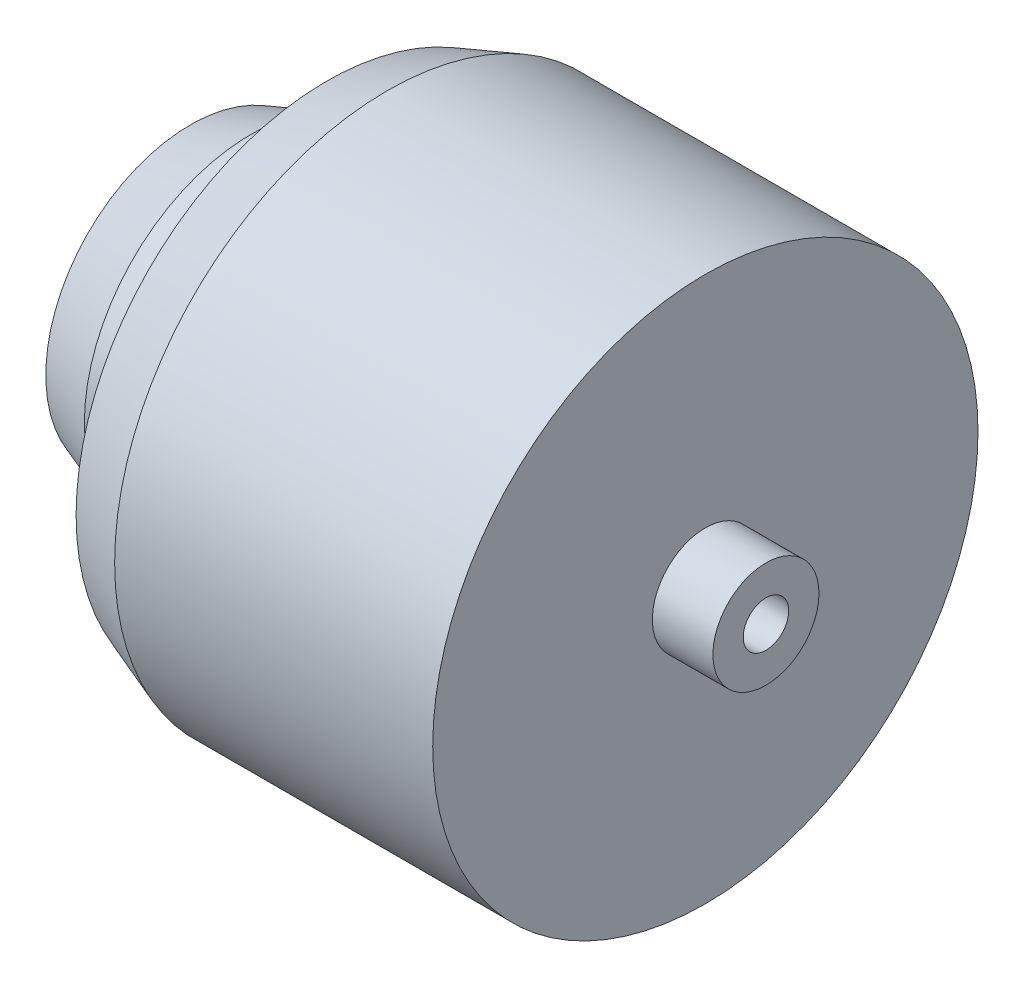
from build123d import *
from OCP.BRepFilletAPI import BRepFilletAPI_MakeChamfer

# Parameters (mm, degrees)
SKETCH1_R                    = 18
BOSS_EXTRUDE1_DEPTH          = 38
SKETCH2_OUTSIDE_W            = 50.706
SKETCH2_OUTSIDE_H            = 50.706
SKETCH2_OUTSIDE_R            = 3.5
CUT_EXTRUDE1_DEPTH           = 4
SKETCH3_OUTSIDE_W            = 50.706
SKETCH3_OUTSIDE_H            = 50.706
SKETCH3_OUTSIDE_R            = 11
CUT_EXTRUDE2_DEPTH           = 9
CHAMFER1_SIZE                = 4
CHAMFER1_SIZE2               = 1.455880937
F_3_0_3_DIAMETER_HOLE1_D     = 3
F_3_0_3_DIAMETER_HOLE1_DEPTH = 34.098709071
F_3_0_3_DIAMETER_HOLE1_TIP   = 0.901290929


with BuildPart() as part:
    # Sketch1 → Boss-Extrude1 (new body)
    with BuildSketch(Plane(origin=(0, 0, 0), x_dir=(0, 0, -1), z_dir=(1, 0, 0))):
        Circle(SKETCH1_R)
    extrude(amount=BOSS_EXTRUDE1_DEPTH)

    # Sketch2 outside → Cut-Extrude1 (cut)
    with BuildSketch(Plane(origin=(38, 0, 0), x_dir=(0, 0, -1), z_dir=(1, 0, 0))):
        Rectangle(SKETCH2_OUTSIDE_W, SKETCH2_OUTSIDE_H)
        Circle(SKETCH2_OUTSIDE_R, mode=Mode.SUBTRACT)
    extrude(amount=-CUT_EXTRUDE1_DEPTH, mode=Mode.SUBTRACT)

    # Sketch3 outside → Cut-Extrude2 (cut)
    with BuildSketch(Plane.ZY):
        Rectangle(SKETCH3_OUTSIDE_W, SKETCH3_OUTSIDE_H)
        Circle(SKETCH3_OUTSIDE_R, mode=Mode.SUBTRACT)
    extrude(amount=-CUT_EXTRUDE2_DEPTH, mode=Mode.SUBTRACT)

    # Chamfer1: one chamfer whose edges measure the first distance from different faces: ONE call of the kernel's chamfer builder (chamfer() names one face for all edges)
    chamfer1_edges_1 = [part.edges().sort_by_distance(p)[0] for p in [
        (9, 0, 18),
    ]]
    chamfer1_side_1 = [part.faces().sort_by_distance(p)[0] for p in [
        (21.5, 0, 18),
    ]]
    chamfer1_edges_2 = [part.edges().sort_by_distance(p)[0] for p in [
        (0, 0, -11),
    ]]
    chamfer1_side_2 = [part.faces().sort_by_distance(p)[0] for p in [
        (4.5, 0, -11),
    ]]
    chamfer1 = BRepFilletAPI_MakeChamfer(part.part.solid().wrapped)
    for e in chamfer1_edges_1:
        chamfer1.Add(CHAMFER1_SIZE, CHAMFER1_SIZE2, e.wrapped, chamfer1_side_1[0].wrapped)  # the first distance lies on this face
    for e in chamfer1_edges_2:
        chamfer1.Add(CHAMFER1_SIZE, CHAMFER1_SIZE2, e.wrapped, chamfer1_side_2[0].wrapped)  # the first distance lies on this face
    add(Compound.cast(chamfer1.Shape()), mode=Mode.REPLACE)

    # Ø3.0 (3) Diameter Hole1
    with Locations(Plane(origin=(38, 0, 0), x_dir=(0, 0, -1), z_dir=(1, 0, 0))):
        with Locations((0, 0)):
            Hole(F_3_0_3_DIAMETER_HOLE1_D / 2, depth=F_3_0_3_DIAMETER_HOLE1_DEPTH)
            with Locations((0, 0, -(F_3_0_3_DIAMETER_HOLE1_DEPTH + F_3_0_3_DIAMETER_HOLE1_TIP / 2))):  # 118° drill point
                Cone(0, F_3_0_3_DIAMETER_HOLE1_D / 2, F_3_0_3_DIAMETER_HOLE1_TIP, mode=Mode.SUBTRACT)


solid = part.part
